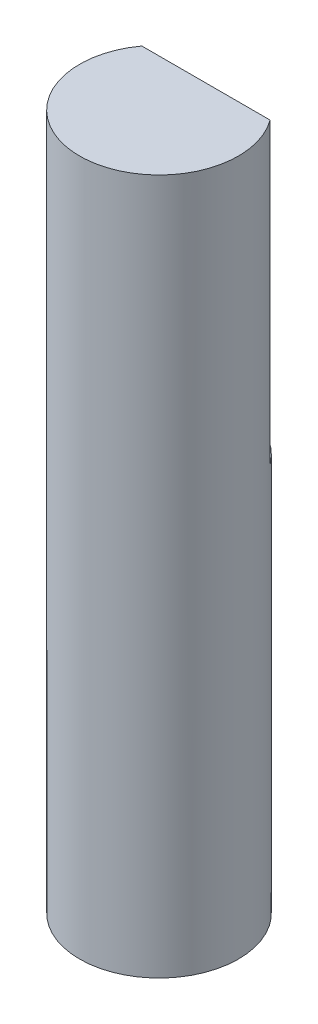
from build123d import *
from build123d.topology import SkipClean

# Parameters (mm, degrees)
BOSS_EXTRUDE1_DEPTH = 44.45
BOSS_EXTRUDE2_DEPTH = 25.4


with BuildPart() as part:
    # Sketch1 → Boss-Extrude1 (new body)
    with BuildSketch(Plane(origin=(0, 0, 0), x_dir=(1, 0, 0), z_dir=(0, 1, 0))):
        with BuildLine():
            Line((-4.099560952, 3), (4.099560952, 3))
            ThreePointArc((4.099560952, 3), (0, -5.08), (-4.099560952, 3))
        make_face()
    extrude(amount=BOSS_EXTRUDE1_DEPTH)

    # Sketch3 → Boss-Extrude2 (add)
    with SkipClean():  # the faces are left unmerged after this step: merging them gives an invalid solid
        with BuildSketch(Plane.XZ):
            with BuildLine():
                Line((-4.099560952, -3), (4.099560952, -3))
                ThreePointArc((4.099560952, -3), (0, -5.08), (-4.099560952, -3))
            make_face()
        extrude(amount=-BOSS_EXTRUDE2_DEPTH)


solid = part.part
